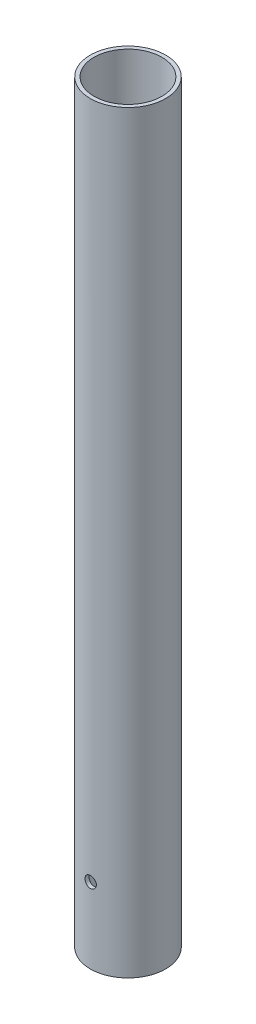
from build123d import *

# Parameters (mm, degrees)
SKETCH_1_R               = 10
SKETCH_1_R_2             = 9
EXTRUDE_1_DEPTH          = 200
CUT_EXTRUDE_1_DEPTH      = 201.499376558
CUT_EXTRUDE_1_DEPTH_BACK = 201.499376558
SKETCH_2_R               = 1.5


with BuildPart() as part:
    # 草图1 → 凸台-拉伸1 (new body)
    with BuildSketch(Plane(origin=(0, 0, 0), x_dir=(1, 0, 0), z_dir=(0, 1, 0))):
        with Locations(Location((0, 0, 0), (0, 0, 270))):
            Circle(SKETCH_1_R)
        with Locations(Location((0, 0, 0), (0, 0, 270))):
            Circle(SKETCH_1_R_2, mode=Mode.SUBTRACT)
    extrude(amount=EXTRUDE_1_DEPTH)

    # 草图2 → 切除-拉伸1 (cut, two sides: drawn at the far end of the back side and taken through both)
    with BuildSketch(Plane.XY.offset(-CUT_EXTRUDE_1_DEPTH_BACK)):
        with Locations((0, 20)):
            Circle(SKETCH_2_R)
    extrude(amount=CUT_EXTRUDE_1_DEPTH + CUT_EXTRUDE_1_DEPTH_BACK, mode=Mode.SUBTRACT)


solid = part.part
